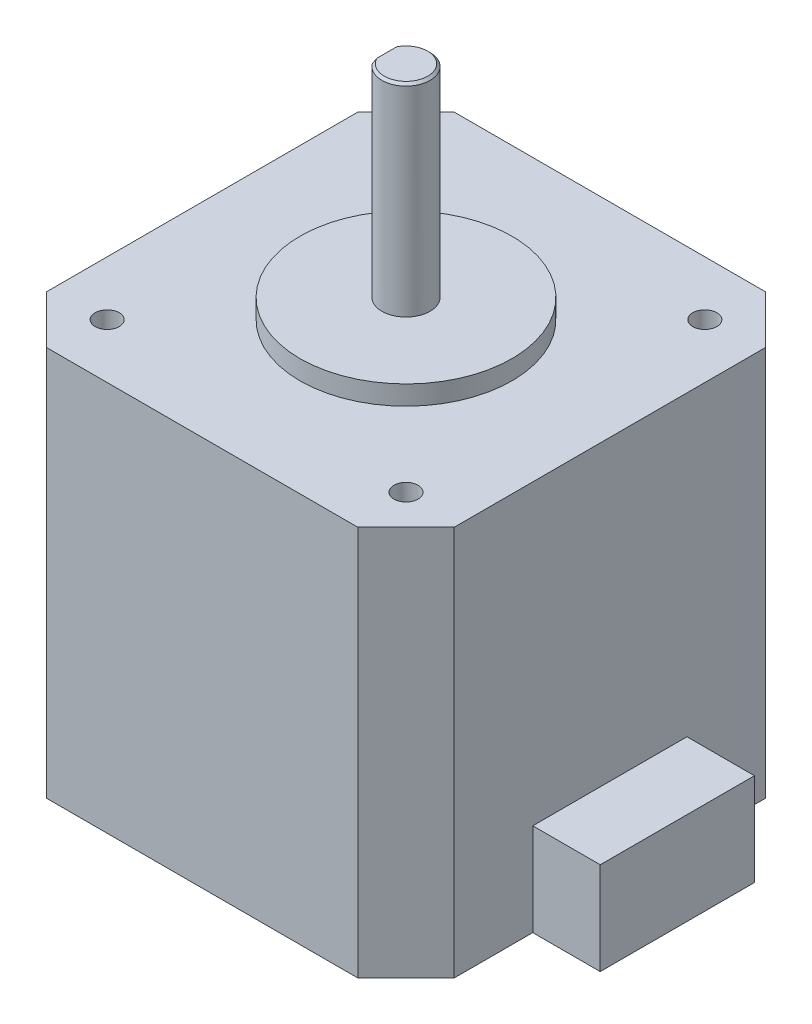
from build123d import *

# Parameters (mm, degrees)
SKETCH1_W                 = 42.3
SKETCH1_H                 = 42.3
BOSS_EXTRUDE1_DEPTH       = 40.5
M3X0_5_TAPPED_HOLE2_D     = 2.5
M3X0_5_TAPPED_HOLE2_DEPTH = 6
M3X0_5_TAPPED_HOLE2_TIP   = 0.751075774
CHAMFER1_SIZE             = 5
SKETCH2_R                 = 11
BOSS_EXTRUDE2_DEPTH       = 2
SKETCH3_R                 = 2.5
BOSS_EXTRUDE3_DEPTH       = 23
CHAMFER2_SIZE             = 0.25
CUT_EXTRUDE1_DEPTH        = 71.191844256
CUT_EXTRUDE1_DEPTH_BACK   = 71.191844256
SKETCH7_W                 = 0.5
SKETCH7_H                 = 18
SKETCH4_W                 = 16
SKETCH4_H                 = 9.6
BOSS_EXTRUDE4_DEPTH       = 7


with BuildPart() as part:
    # Sketch1 → Boss-Extrude1 (new body)
    with BuildSketch(Plane(origin=(0, 0, 0), x_dir=(1, 0, 0), z_dir=(0, 1, 0))):
        Rectangle(SKETCH1_W, SKETCH1_H)
    extrude(amount=BOSS_EXTRUDE1_DEPTH)

    # M3x0.5 Tapped Hole2
    with Locations(Plane(origin=(0, 40.5, 0), x_dir=(1, 0, 0), z_dir=(0, 1, 0))):
        with Locations((0, 0), (15.5, 15.5), (-15.5, -15.5), (-15.5, 15.5), (15.5, -15.5)):
            Hole(M3X0_5_TAPPED_HOLE2_D / 2, depth=M3X0_5_TAPPED_HOLE2_DEPTH)
            with Locations((0, 0, -(M3X0_5_TAPPED_HOLE2_DEPTH + M3X0_5_TAPPED_HOLE2_TIP / 2))):  # 118° drill point
                Cone(0, M3X0_5_TAPPED_HOLE2_D / 2, M3X0_5_TAPPED_HOLE2_TIP, mode=Mode.SUBTRACT)

    # Chamfer1
    chamfer1_edges = [part.edges().sort_by_distance(p)[0] for p in [
        (21.15, 20.25, 21.15),
        (-21.15, 20.25, 21.15),
        (-21.15, 20.25, -21.15),
        (21.15, 20.25, -21.15),
    ]]
    chamfer(chamfer1_edges, length=CHAMFER1_SIZE)

    # Sketch2 → Boss-Extrude2 (add)
    with BuildSketch(Plane(origin=(0, 40.5, 0), x_dir=(1, 0, 0), z_dir=(0, 1, 0))):
        with Locations(Location((0, 0, 0), (0, 0, 270))):
            Circle(SKETCH2_R)
    extrude(amount=BOSS_EXTRUDE2_DEPTH)

    # Sketch3 → Boss-Extrude3 (add)
    with BuildSketch(Plane(origin=(0, 40.5, 0), x_dir=(1, 0, 0), z_dir=(0, 1, 0))):
        with Locations(Location((0, 0, 0), (0, 0, 270))):
            Circle(SKETCH3_R)
    extrude(amount=BOSS_EXTRUDE3_DEPTH)

    # Chamfer2
    chamfer2_edges = [part.edges().sort_by_distance(p)[0] for p in [
        (0, 63.5, -2.5),
    ]]
    chamfer(chamfer2_edges, length=CHAMFER2_SIZE)

    # Sketch7 → Cut-Extrude1 (cut, two sides: drawn at the far end of the back side and taken through both)
    with BuildSketch(Plane.XY.offset(-CUT_EXTRUDE1_DEPTH_BACK)):
        with Locations((-2.25, 54.5)):
            Rectangle(SKETCH7_W, SKETCH7_H)
    extrude(amount=CUT_EXTRUDE1_DEPTH + CUT_EXTRUDE1_DEPTH_BACK, mode=Mode.SUBTRACT)

    # Sketch4 → Boss-Extrude4 (add)
    with BuildSketch(Plane(origin=(21.15, 0, 0), x_dir=(0, 0, -1), z_dir=(1, 0, 0))):
        with Locations((0, 4.8)):
            Rectangle(SKETCH4_W, SKETCH4_H)
    extrude(amount=BOSS_EXTRUDE4_DEPTH)


solid = part.part
